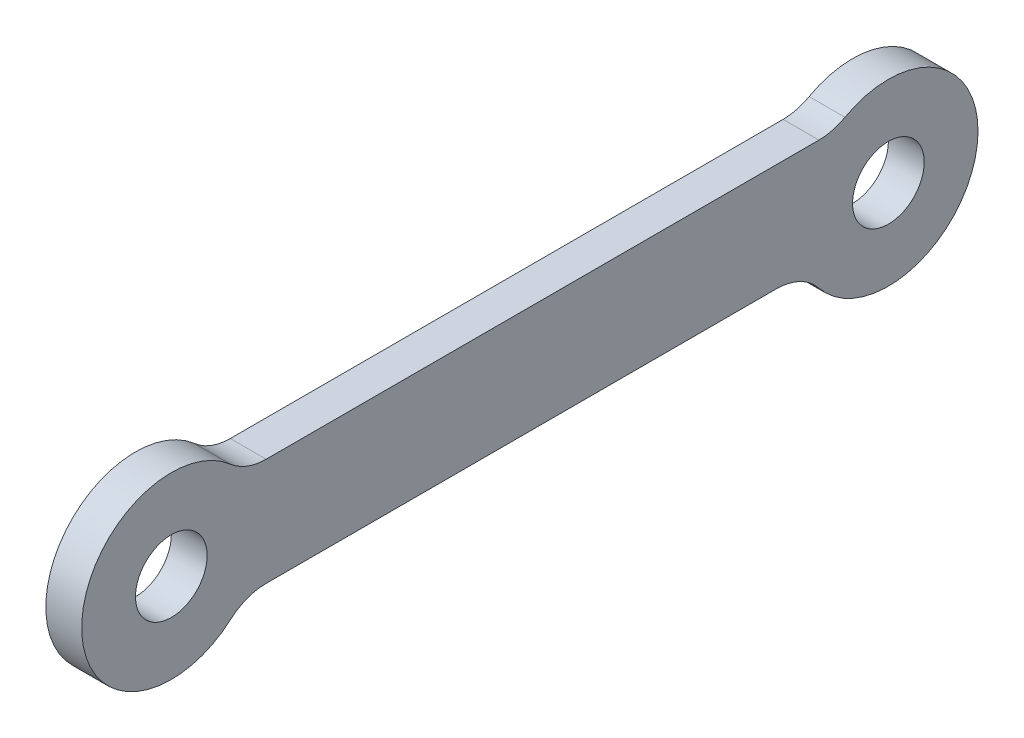
from build123d import *

# Parameters (mm, degrees)
SKETCH_1_R               = 5
SKETCH_1_W               = 40
SKETCH_1_H               = 6
EXTRUDE_1_DEPTH          = 2
CUT_EXTRUDE_2_DEPTH      = 46.44227107
CUT_EXTRUDE_2_DEPTH_BACK = 46.44227107
SKETCH_1_3_R             = 2
FILLET_1_R               = 3


with BuildPart() as part:
    # 草图1 → 凸台-拉伸1 (new body)
    with BuildSketch(Plane(origin=(0, 0, 0), x_dir=(0, 0, -1), z_dir=(1, 0, 0))):
        Circle(SKETCH_1_R)
        with Locations((40, -1)):
            Circle(SKETCH_1_R)
        with Locations((20, 0)):
            Rectangle(SKETCH_1_W, SKETCH_1_H)
    extrude(amount=EXTRUDE_1_DEPTH)

    # 草图1<3> → 切除-拉伸2 (cut, two sides: drawn at the far end of the back side and taken through both)
    with BuildSketch(Plane(origin=(0, 0, 0), x_dir=(0, 0, -1), z_dir=(1, 0, 0)).offset(-CUT_EXTRUDE_2_DEPTH_BACK)):
        Circle(SKETCH_1_3_R)
        with Locations((40, -1)):
            Circle(SKETCH_1_3_R)
    extrude(amount=CUT_EXTRUDE_2_DEPTH + CUT_EXTRUDE_2_DEPTH_BACK, mode=Mode.SUBTRACT)

    # 圆角1
    fillet_1_edges = [part.edges().sort_by_distance(p)[0] for p in [
        (1, -3, -4),
        (1, -3, -35.417424305),
        (1, 3, -37),
        (1, 3, -4),
    ]]
    fillet(fillet_1_edges, radius=FILLET_1_R)


solid = part.part
